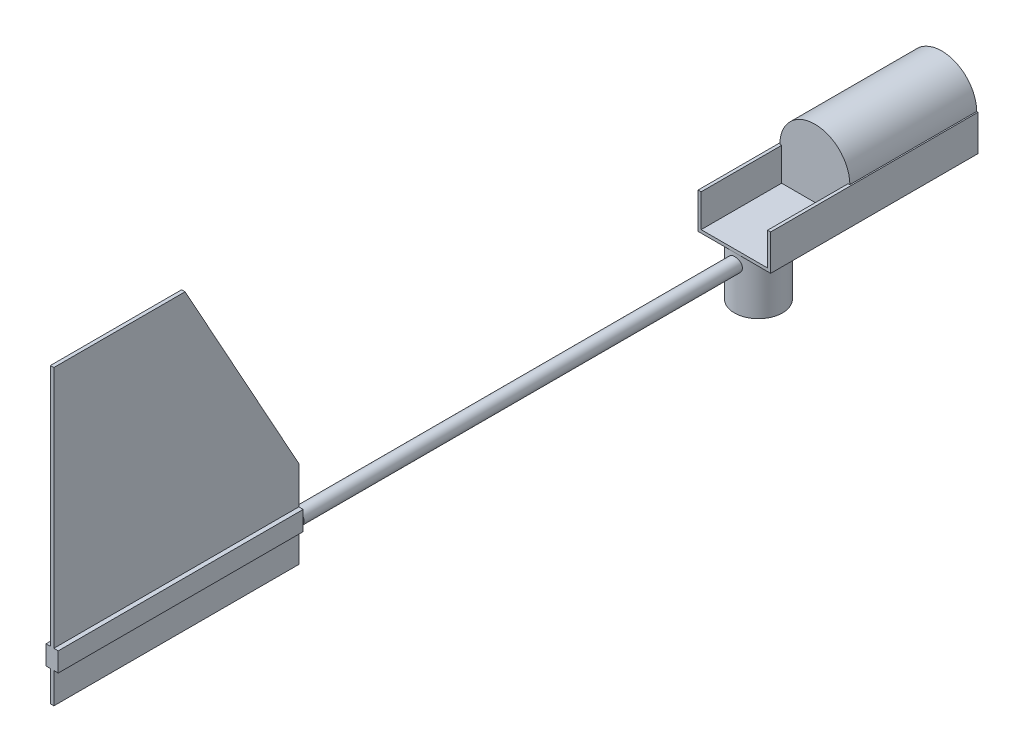
from build123d import *

# Parameters (mm, degrees)
P_IDAT_VYSUNUT_M1_DEPTH      = 145
P_IDAT_VYSUNUT_M2_DEPTH      = 92
SKICA3_R                     = 27.5
P_IDAT_VYSUNUT_M3_DEPTH      = 60
P_IDAT_VYSUNUT_M4_DEPTH      = 500
P_IDAT_VYSUNUT_M4_DEPTH_BACK = 40
SKICA4_R                     = 8
P_IDAT_VYSUNUT_M5_DEPTH      = 2
P_IDAT_VYSUNUT_M5_DEPTH_BACK = 2
SKICA6_W                     = 280
SKICA6_H                     = 22
P_IDAT_VYSUNUT_M6_DEPTH      = 5


with BuildPart() as part:
    # Skica1 → Přidat vysunutím1 (new body)
    with BuildSketch(Plane.XY):
        with BuildLine():
            Line((-41.5, 0), (-41.5, -41))
            Line((-41.5, -41), (41.5, -41))
            Line((41.5, -41), (41.5, 0))
            Line((41.5, 0), (40, 0))
            ThreePointArc((40, 0), (0, 40), (-40, 0))
            Line((-40, 0), (-41.5, 0))
        make_face()
    extrude(amount=P_IDAT_VYSUNUT_M1_DEPTH)

    # Skica2 → Přidat vysunutím2 (add)
    with BuildSketch(Plane.XY.offset(145)):
        Polygon((-41.5, 0), (-38, 0), (-38, -37.5), (38, -37.5), (38, 0), (41.5, 0), (41.5, -41), (-41.5, -41), align=None)
    extrude(amount=P_IDAT_VYSUNUT_M2_DEPTH)

    # Skica3 → Přidat vysunutím3 (add)
    with BuildSketch(Plane.XZ.offset(41)):
        with Locations(Location((0, 209.5, 0), (0, 0, 90))):
            Circle(SKICA3_R)
    extrude(amount=P_IDAT_VYSUNUT_M3_DEPTH)

    # Skica4 → Přidat vysunutím4 (add, two sides: drawn at the far end of the back side and taken through both)
    with BuildSketch(Plane.XY.offset(237).offset(-P_IDAT_VYSUNUT_M4_DEPTH_BACK)):
        with Locations((0, -53)):
            Circle(SKICA4_R)
    extrude(amount=P_IDAT_VYSUNUT_M4_DEPTH + P_IDAT_VYSUNUT_M4_DEPTH_BACK)

    # Skica5 → Přidat vysunutím5 (add, two sides: drawn at the far end of the back side and taken through both)
    with BuildSketch(Plane(origin=(0, 0, 0), x_dir=(0, 0, -1), z_dir=(1, 0, 0)).offset(-P_IDAT_VYSUNUT_M5_DEPTH_BACK)):
        Polygon((-737, 1), (-737, -99), (-1017, -99), (-1017, 236), (-867, 236), align=None)
    extrude(amount=P_IDAT_VYSUNUT_M5_DEPTH + P_IDAT_VYSUNUT_M5_DEPTH_BACK)

    # Skica6 → Přidat vysunutím6 (add)
    with BuildSketch(Plane(origin=(2, 0, 0), x_dir=(0, 0, -1), z_dir=(1, 0, 0))):
        with Locations((-877, -53)):
            Rectangle(SKICA6_W, SKICA6_H)
    p_idat_vysunut_m6 = extrude(amount=P_IDAT_VYSUNUT_M6_DEPTH)

    # Zrcadlit1: Přidat vysunutím6 across plane
    add(p_idat_vysunut_m6.mirror(Plane(origin=(0, 0, 0), x_dir=(0, 0, 1), z_dir=(1, 0, 0))))


solid = part.part
